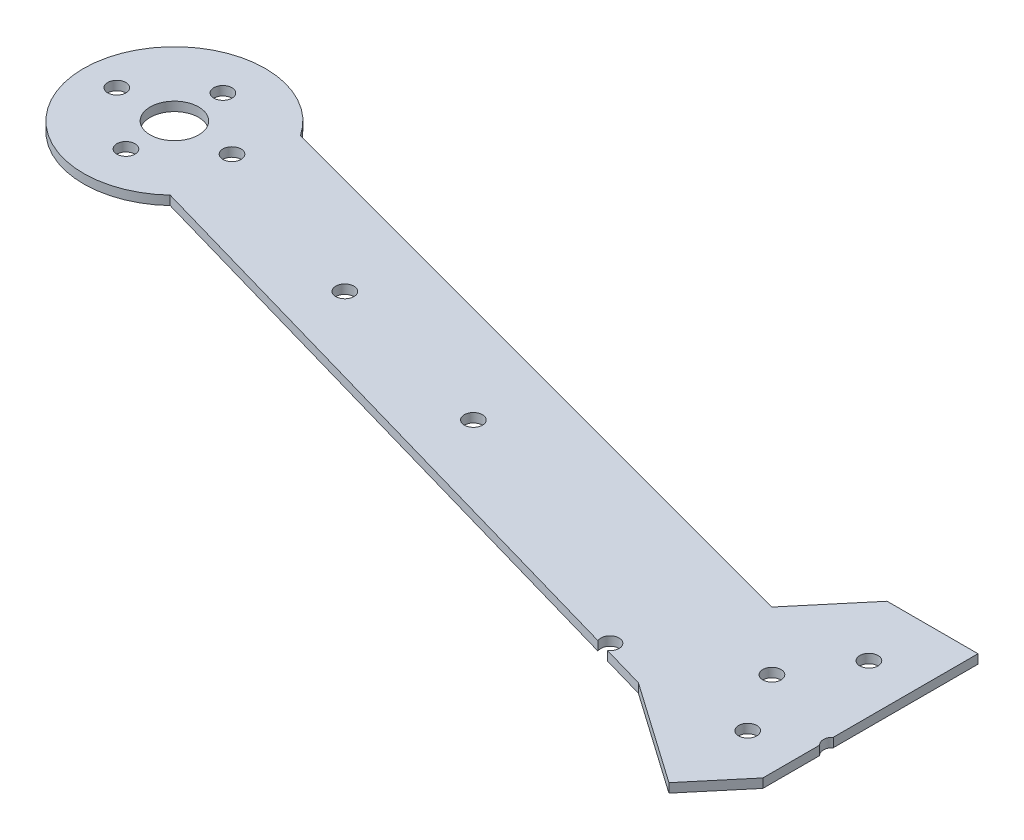
from build123d import *

# Parameters (mm, degrees)
SKETCH1_R           = 1.5
SKETCH1_R_2         = 4
BOSS_EXTRUDE1_DEPTH = 1.5


with BuildPart() as part:
    # Sketch1 → Boss-Extrude1 (new body)
    with BuildSketch(Plane(origin=(0, 0, 0), x_dir=(1, 0, 0), z_dir=(0, 1, 0))):
        with BuildLine():
            Line((-7.070663707, -8.426488874), (0, 0))
            Line((0, 0), (0, 9.381966011))
            ThreePointArc((0, 9.381966011), (-0.5, 10.5), (0, 11.618033989))
            Line((0, 11.618033989), (0, 35.5))
            Line((0, 35.5), (-15, 35.5))
            Line((-15, 35.5), (-23.677632731, 25.158400018))
            Line((-23.677632731, 25.158400018), (-129.929473623, 53.628494979))
            ThreePointArc((-129.929473623, 53.628494979), (-157.327989791, 47.078833109), (-132.17932297, 34.38547595))
            Line((-132.17932297, 34.38547595), (-33.223789423, 6.015437425))
            ThreePointArc((-33.223789423, 6.015437425), (-31.446611343, 8.081911862), (-31.03429168, 5.387719772))
            Line((-31.03429168, 5.387719772), (-23.863280614, 3.331828071))
            Line((-23.863280614, 3.331828071), (-7.070663707, -8.426488874))
        make_face()
        with Locations(Location((-8, 5.5, 0), (0, 0, 270))):
            Circle(SKETCH1_R, mode=Mode.SUBTRACT)
        with Locations(Location((-14, 15.5, 0), (0, 0, 270))):
            Circle(SKETCH1_R, mode=Mode.SUBTRACT)
        with Locations(Location((-8, 25.5, 0), (0, 0, 270))):
            Circle(SKETCH1_R, mode=Mode.SUBTRACT)
        with Locations(Location((-142.429473623, 37.336933003, 0), (0, 0, 270))):
            Circle(SKETCH1_R, mode=Mode.SUBTRACT)
        with Locations(Location((-104.014603511, 35.04369958, 0), (0, 0, 270))):
            Circle(SKETCH1_R, mode=Mode.SUBTRACT)
        with Locations(Location((-151.929473623, 45.336933003, 0), (0, 0, 270))):
            Circle(SKETCH1_R, mode=Mode.SUBTRACT)
        with Locations(Location((-142.429473623, 45.336933003, 0), (0, 0, 270))):
            Circle(SKETCH1_R_2, mode=Mode.SUBTRACT)
        with Locations(Location((-132.929473623, 45.336933003, 0), (0, 0, 270))):
            Circle(SKETCH1_R, mode=Mode.SUBTRACT)
        with Locations(Location((-142.429473623, 53.336933003, 0), (0, 0, 270))):
            Circle(SKETCH1_R, mode=Mode.SUBTRACT)
        with Locations(Location((-75.036828722, 27.279128226, 0), (0, 0, 270))):
            Circle(SKETCH1_R, mode=Mode.SUBTRACT)
    extrude(amount=BOSS_EXTRUDE1_DEPTH)


solid = part.part
